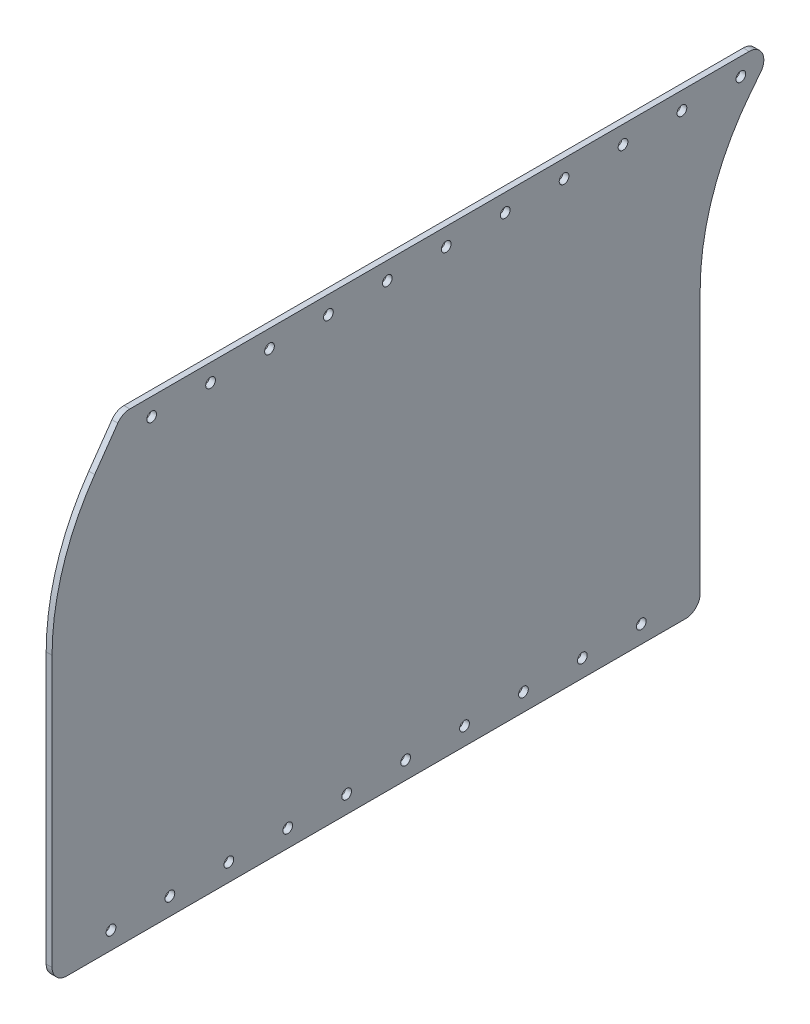
from build123d import *

# Parameters (mm, degrees)
SKETCH1_R           = 2.0955
BOSS_EXTRUDE1_DEPTH = 1.27
FILLET1_R           = 6.35
FILLET2_R           = 101.6


with BuildPart() as part:
    # Sketch1 → Boss-Extrude1 (new, symmetric)
    with BuildSketch(Plane(origin=(0, 0, 0), x_dir=(0, 0, -1), z_dir=(1, 0, 0))):
        Polygon((-138.948360469, -3.051094372), (140.451639531, -3.051094372), (140.451639531, 151.896865158), (174.673969175, 195.068905628), (-108.718972293, 195.068905628), (-138.948360469, 151.896865158), align=None)
        with Locations((-113.548360469, 4.568905628)):
            Circle(SKETCH1_R, mode=Mode.SUBTRACT)
        with Locations((-88.148360469, 4.568905628)):
            Circle(SKETCH1_R, mode=Mode.SUBTRACT)
        with Locations((-62.748360469, 4.568905628)):
            Circle(SKETCH1_R, mode=Mode.SUBTRACT)
        with Locations((-37.348360469, 4.568905628)):
            Circle(SKETCH1_R, mode=Mode.SUBTRACT)
        with Locations((-11.948360469, 4.568905628)):
            Circle(SKETCH1_R, mode=Mode.SUBTRACT)
        with Locations((13.451639531, 4.568905628)):
            Circle(SKETCH1_R, mode=Mode.SUBTRACT)
        with Locations((38.851639531, 4.568905628)):
            Circle(SKETCH1_R, mode=Mode.SUBTRACT)
        with Locations((64.251639531, 4.568905628)):
            Circle(SKETCH1_R, mode=Mode.SUBTRACT)
        with Locations((89.651639531, 4.568905628)):
            Circle(SKETCH1_R, mode=Mode.SUBTRACT)
        with Locations((115.051639531, 4.568905628)):
            Circle(SKETCH1_R, mode=Mode.SUBTRACT)
        with Locations((-96.018972293, 187.448905628)):
            Circle(SKETCH1_R, mode=Mode.SUBTRACT)
        with Locations((-70.618972293, 187.448905628)):
            Circle(SKETCH1_R, mode=Mode.SUBTRACT)
        with Locations((-45.218972293, 187.448905628)):
            Circle(SKETCH1_R, mode=Mode.SUBTRACT)
        with Locations((-19.818972293, 187.448905628)):
            Circle(SKETCH1_R, mode=Mode.SUBTRACT)
        with Locations((5.581027707, 187.448905628)):
            Circle(SKETCH1_R, mode=Mode.SUBTRACT)
        with Locations((30.981027707, 187.448905628)):
            Circle(SKETCH1_R, mode=Mode.SUBTRACT)
        with Locations((56.381027707, 187.448905628)):
            Circle(SKETCH1_R, mode=Mode.SUBTRACT)
        with Locations((81.781027707, 187.448905628)):
            Circle(SKETCH1_R, mode=Mode.SUBTRACT)
        with Locations((107.181027707, 187.448905628)):
            Circle(SKETCH1_R, mode=Mode.SUBTRACT)
        with Locations((132.581027707, 187.448905628)):
            Circle(SKETCH1_R, mode=Mode.SUBTRACT)
        with Locations((157.981027707, 187.448905628)):
            Circle(SKETCH1_R, mode=Mode.SUBTRACT)
    extrude(amount=BOSS_EXTRUDE1_DEPTH, both=True)

    # Fillet1
    fillet1_edges = [part.edges().sort_by_distance(p)[0] for p in [
        (0, -3.051094372, -140.451639531),
        (0, -3.051094372, 138.948360469),
        (0, 195.068905628, 108.718972293),
        (0, 195.068905628, -174.673969175),
    ]]
    fillet(fillet1_edges, radius=FILLET1_R)

    # Fillet2
    fillet2_edges = [part.edges().sort_by_distance(p)[0] for p in [
        (0, 151.896865158, -140.451639531),
        (0, 151.896865158, 138.948360469),
    ]]
    fillet(fillet2_edges, radius=FILLET2_R)


solid = part.part
